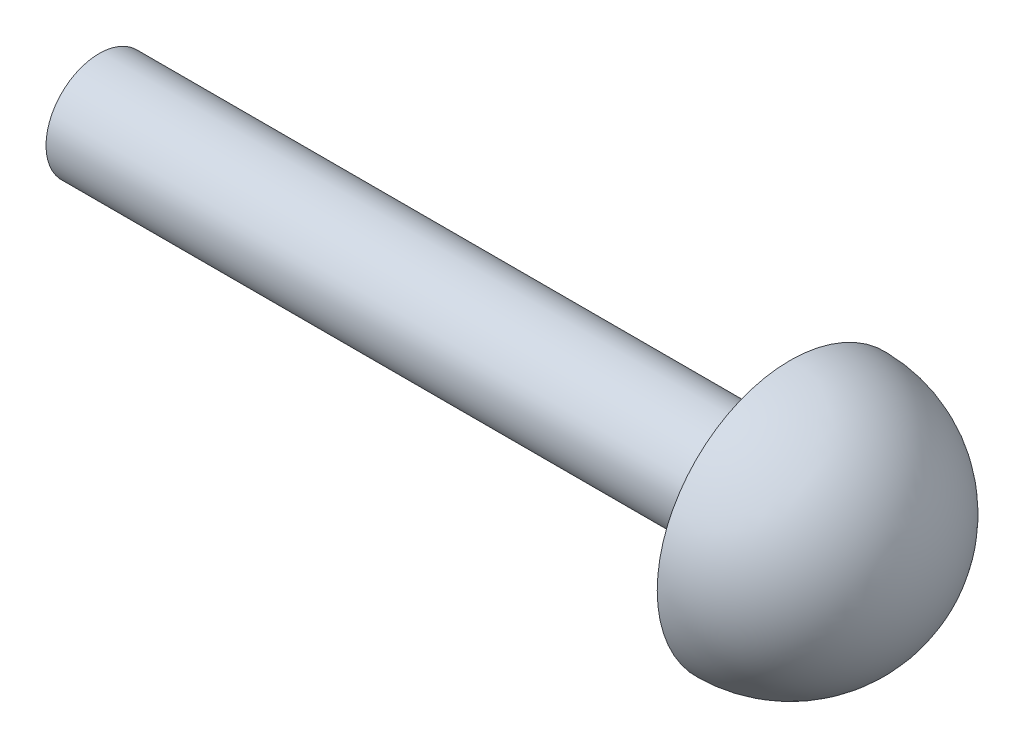
from build123d import *


with BuildPart() as part:
    # Sketch1 → Revolve1 (revolve)
    with BuildSketch(Plane.XY):
        with BuildLine():
            Line((0, 0), (0, 2))
            Line((0, 2), (26, 2))
            Line((26, 2), (26, 5))
            ThreePointArc((26, 5), (29.535533906, 3.535533906), (31, 0))
            Line((31, 0), (0, 0))
        make_face()
    revolve(axis=Axis((0, 0, 0), (1, 0, 0)))


solid = part.part
